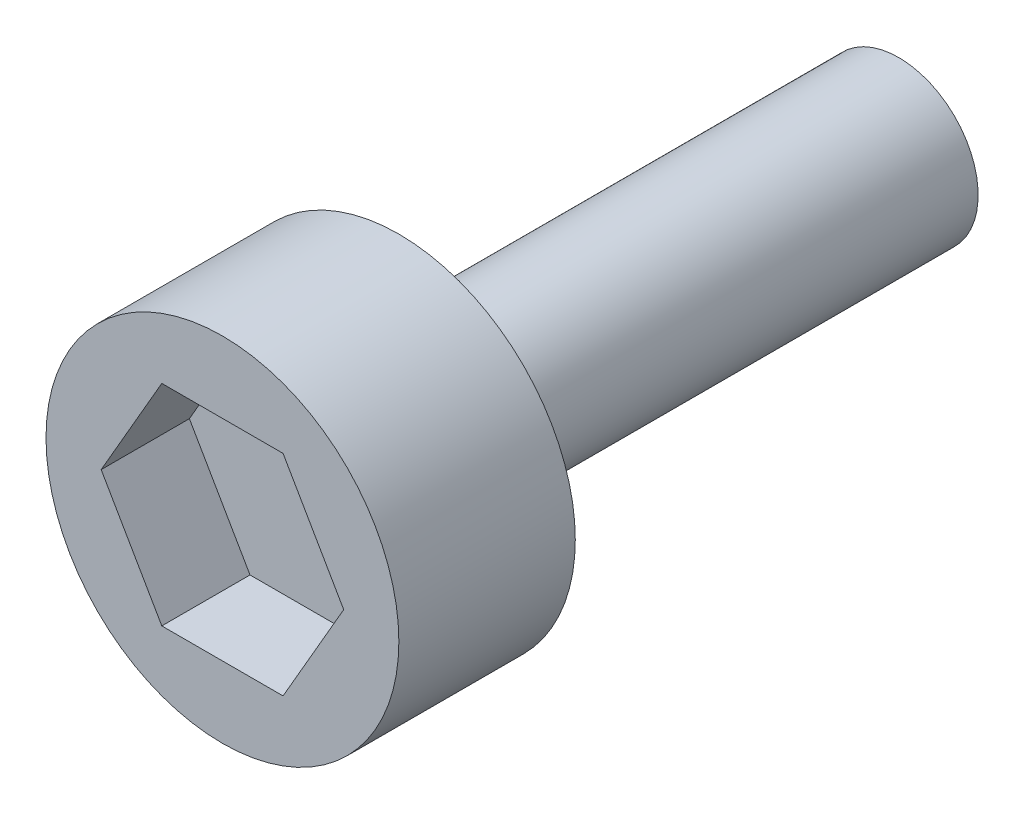
from build123d import *

# Parameters (mm, degrees)
SKETCH1_R           = 3
BOSS_EXTRUDE1_DEPTH = 3
CUT_EXTRUDE1_DEPTH  = 1.5
SKETCH4_R           = 1.35
BOSS_EXTRUDE2_DEPTH = 8.5


with BuildPart() as part:
    # Sketch1 → Boss-Extrude1 (new body)
    with BuildSketch(Plane.XY):
        Circle(SKETCH1_R)
    extrude(amount=BOSS_EXTRUDE1_DEPTH)

    # Sketch2 → Cut-Extrude1 (cut)
    with BuildSketch(Plane.XY.offset(3)):
        Polygon((2.06190779, 0), (1.030953895, 1.785664527), (-1.030953895, 1.785664527), (-2.06190779, 0), (-1.030953895, -1.785664527), (1.030953895, -1.785664527), align=None)
    extrude(amount=-CUT_EXTRUDE1_DEPTH, mode=Mode.SUBTRACT)

    # Sketch4 → Boss-Extrude2 (add)
    with BuildSketch(Plane(origin=(0, 0, 0), x_dir=(-1, 0, 0), z_dir=(0, 0, -1))):
        Circle(SKETCH4_R)
    extrude(amount=BOSS_EXTRUDE2_DEPTH)


solid = part.part
